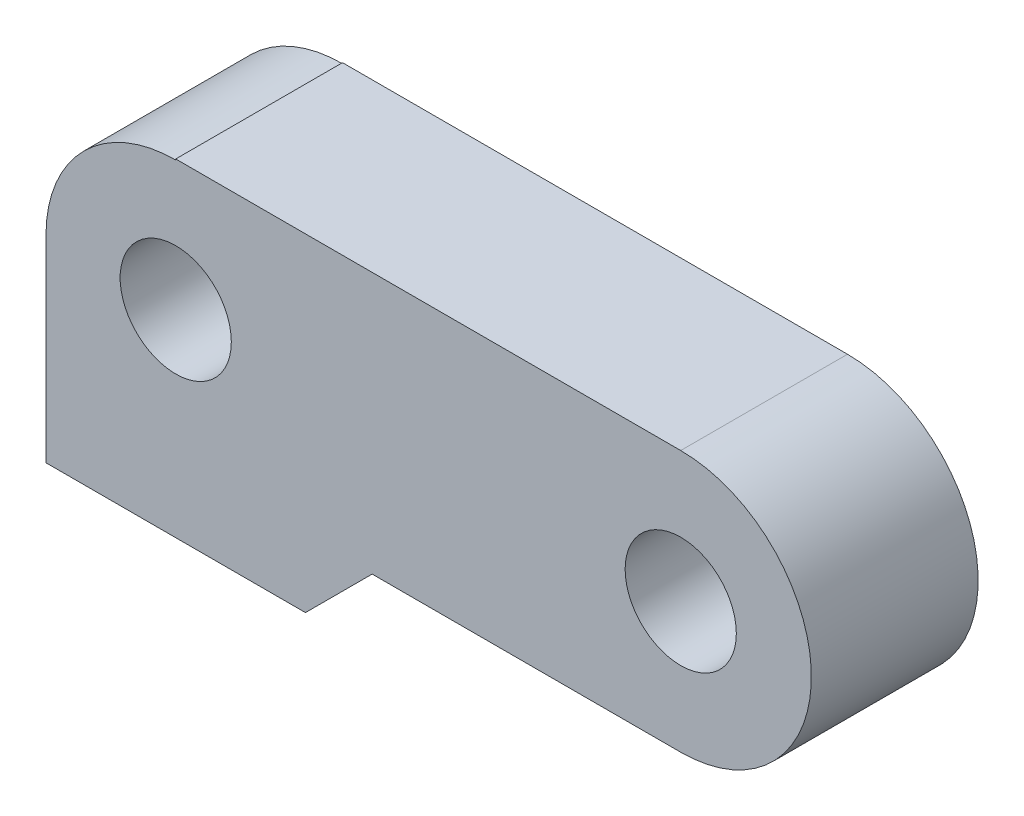
from build123d import *

# Parameters (mm, degrees)
SKETCH1_W           = 83
SKETCH1_H           = 35.4
SKETCH1_R           = 6
BOSS_EXTRUDE1_DEPTH = 18
CUT_EXTRUDE1_DEPTH  = 49.5750965
CUT_EXTRUDE2_DEPTH  = 49.5750965
SKETCH4_R           = 10
CUT_EXTRUDE3_DEPTH  = 5


with BuildPart() as part:
    # Sketch1 → Boss-Extrude1 (new body)
    with BuildSketch(Plane.XY):
        Rectangle(SKETCH1_W, SKETCH1_H)
        with Locations((-27.5, 3.6)):
            Circle(SKETCH1_R, mode=Mode.SUBTRACT)
        with Locations((27, 3.6)):
            Circle(SKETCH1_R, mode=Mode.SUBTRACT)
    extrude(amount=BOSS_EXTRUDE1_DEPTH)

    # Sketch2 → Cut-Extrude1 (cut, through all)
    with BuildSketch(Plane.XY.offset(18)):
        with BuildLine():
            Line((27, -10.5), (-6.3, -10.5))
            Line((-6.3, -10.5), (-13.5, -17.7))
            Line((-13.5, -17.7), (-41.5, -17.7))
            Line((-41.5, -17.7), (-41.5, -37.108146422))
            Line((-41.5, -37.108146422), (58.064931867, -37.108146422))
            Line((58.064931867, -37.108146422), (58.064931867, 31.4831893))
            Line((58.064931867, 31.4831893), (27, 31.4831893))
            Line((27, 31.4831893), (27, 17.7))
            ThreePointArc((27, 17.7), (41.1, 3.6), (27, -10.5))
        make_face()
    extrude(amount=-CUT_EXTRUDE1_DEPTH, mode=Mode.SUBTRACT)

    # Sketch3 → Cut-Extrude2 (cut, through all)
    with BuildSketch(Plane.XY.offset(18)):
        with BuildLine():
            Line((-27.5, 17.6), (-27.5, 27.141783499))
            Line((-27.5, 27.141783499), (-58.476255023, 27.141783499))
            Line((-58.476255023, 27.141783499), (-58.476255023, 3.6))
            Line((-58.476255023, 3.6), (-41.5, 3.6))
            ThreePointArc((-41.5, 3.6), (-37.399494937, 13.499494937), (-27.5, 17.6))
        make_face()
    extrude(amount=-CUT_EXTRUDE2_DEPTH, mode=Mode.SUBTRACT)

    # Sketch4 → Cut-Extrude3 (cut)
    with BuildSketch(Plane(origin=(0, 0, 0), x_dir=(-1, 0, 0), z_dir=(0, 0, -1))):
        with Locations((-27, 3.6)):
            Circle(SKETCH4_R)
    extrude(amount=-CUT_EXTRUDE3_DEPTH, mode=Mode.SUBTRACT)


solid = part.part
